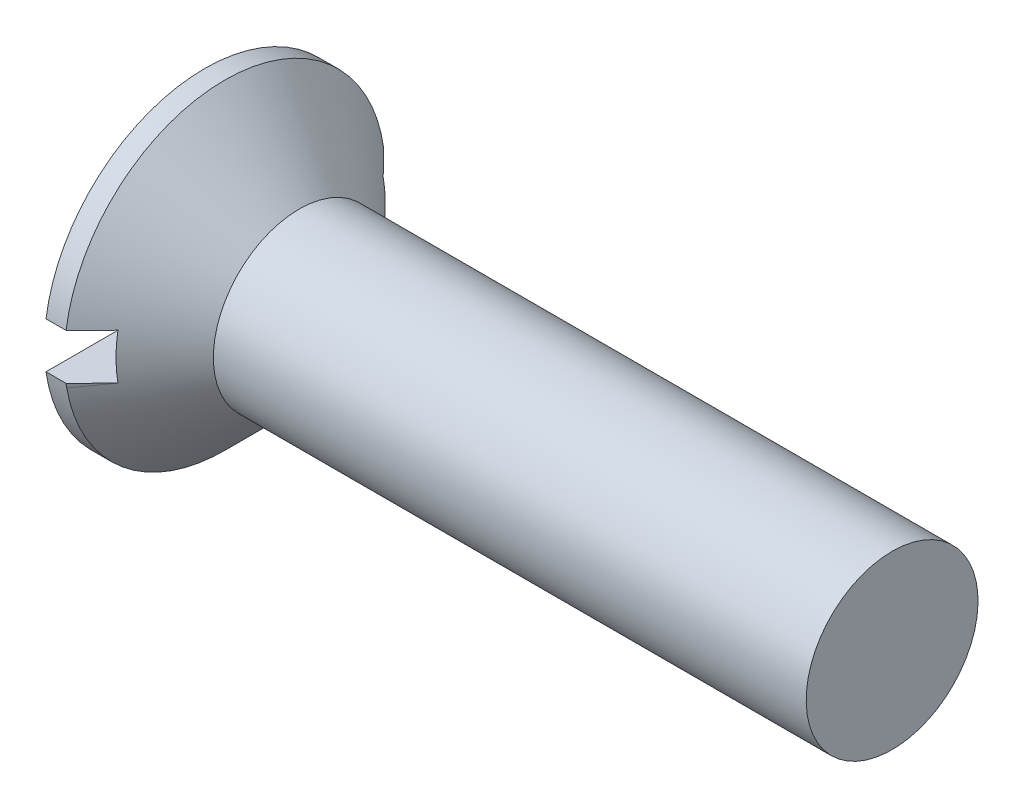
from build123d import *

# Parameters (mm, degrees)
SKETCH2_W          = 5.6
SKETCH2_H          = 0.8
CUT_EXTRUDE1_DEPTH = 0.8


with BuildPart() as part:
    # Sketch1 → Revolve1 (revolve)
    with BuildSketch(Plane.XY):
        Polygon((0, 0), (0, 2.8), (0.35, 2.8), (1.65, 1.5), (12, 1.5), (12, 0), align=None)
    revolve(axis=Axis((12, 0, 0), (-1, 0, 0)))

    # Sketch2 → Cut-Extrude1 (cut)
    with BuildSketch(Plane.ZY):
        Rectangle(SKETCH2_W, SKETCH2_H)
    extrude(amount=-CUT_EXTRUDE1_DEPTH, mode=Mode.SUBTRACT)


solid = part.part
